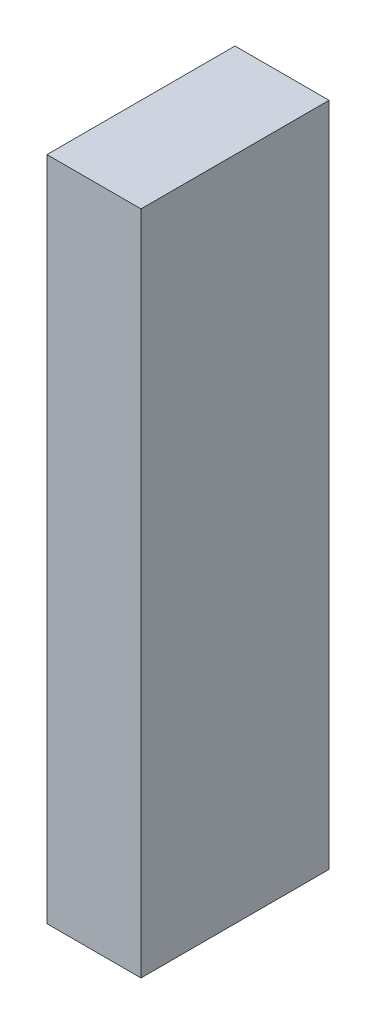
from build123d import *

# Parameters (mm, degrees)
SK_BOARD_W  = 12
SK_BOARD_H  = 85
BOARD_DEPTH = 24


with BuildPart() as part:
    # SK_Board → Board (new body)
    with BuildSketch(Plane.XY.offset(30)):
        with Locations((61, 0)):
            Rectangle(SK_BOARD_W, SK_BOARD_H)
    extrude(amount=BOARD_DEPTH)


solid = part.part
